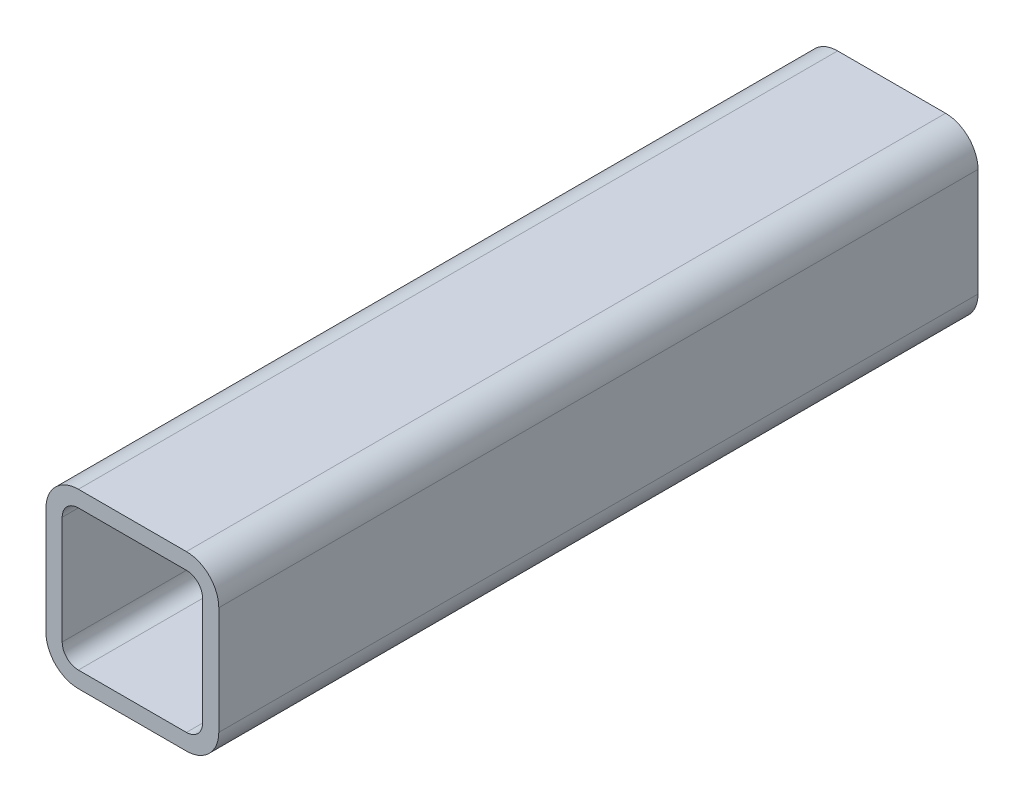
from build123d import *

# Parameters (mm, degrees)
DODANIE_WYCI_GNI_CIE1_DEPTH = 223.2


with BuildPart() as part:
    # Szkic1 → Dodanie-wyciągnięcie1 (new body)
    with BuildSketch(Plane.XY):
        with BuildLine():
            Line((9.53, 0), (41.27, 0))
            ThreePointArc((41.27, 0), (48.008727625, 2.791272375), (50.8, 9.53))
            Line((50.8, 9.53), (50.8, 41.27))
            ThreePointArc((50.8, 41.27), (48.008727625, 48.008727625), (41.27, 50.8))
            Line((41.27, 50.8), (9.53, 50.8))
            ThreePointArc((9.53, 50.8), (2.791272375, 48.008727625), (0, 41.27))
            Line((0, 41.27), (0, 9.53))
            ThreePointArc((0, 9.53), (2.791272375, 2.791272375), (9.53, 0))
        make_face()
        with BuildLine():
            Line((9.52, 46.04), (41.28, 46.04))
            ThreePointArc((41.28, 46.04), (44.645828278, 44.645828278), (46.04, 41.28))
            Line((46.04, 41.28), (46.04, 9.52))
            ThreePointArc((46.04, 9.52), (44.645828278, 6.154171722), (41.28, 4.76))
            Line((41.28, 4.76), (9.52, 4.76))
            ThreePointArc((9.52, 4.76), (6.154171722, 6.154171722), (4.76, 9.52))
            Line((4.76, 9.52), (4.76, 41.28))
            ThreePointArc((4.76, 41.28), (6.154171722, 44.645828278), (9.52, 46.04))
        make_face(mode=Mode.SUBTRACT)
    extrude(amount=DODANIE_WYCI_GNI_CIE1_DEPTH)


solid = part.part
